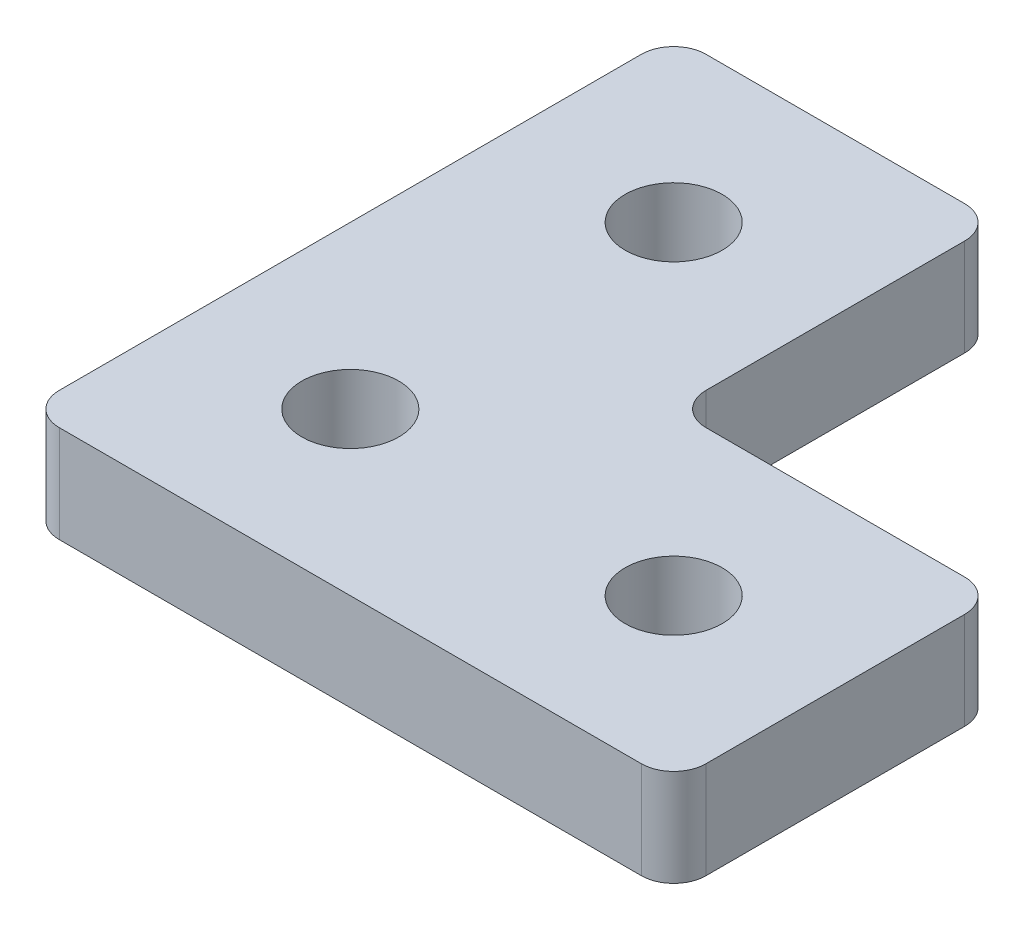
from build123d import *

# Parameters (mm, degrees)
SKETCH1_R           = 1.5
BOSS_EXTRUDE1_DEPTH = 3
FILLET1_R           = 1
FILLET2_R           = 1


with BuildPart() as part:
    # Sketch1 → Boss-Extrude1 (new body)
    with BuildSketch(Plane(origin=(0, 0, 0), x_dir=(1, 0, 0), z_dir=(0, 1, 0))):
        Polygon((0, 0), (10, 0), (20, 0), (20, 10), (10, 10), (10, 20), (0, 20), align=None)
        with Locations(Location((5, 15, 0), (0, 0, 270))):
            Circle(SKETCH1_R, mode=Mode.SUBTRACT)
        with Locations(Location((5, 5, 0), (0, 0, 270))):
            Circle(SKETCH1_R, mode=Mode.SUBTRACT)
        with Locations(Location((15, 5, 0), (0, 0, 270))):
            Circle(SKETCH1_R, mode=Mode.SUBTRACT)
    extrude(amount=BOSS_EXTRUDE1_DEPTH)

    # Fillet1
    fillet1_edges = [part.edges().sort_by_distance(p)[0] for p in [
        (10, 1.5, -10),
    ]]
    fillet(fillet1_edges, radius=FILLET1_R)

    # Fillet2
    fillet2_edges = [part.edges().sort_by_distance(p)[0] for p in [
        (0, 1.5, -20),
        (10, 1.5, -20),
        (20, 1.5, -10),
        (20, 1.5, 0),
        (0, 1.5, 0),
    ]]
    fillet(fillet2_edges, radius=FILLET2_R)


solid = part.part
